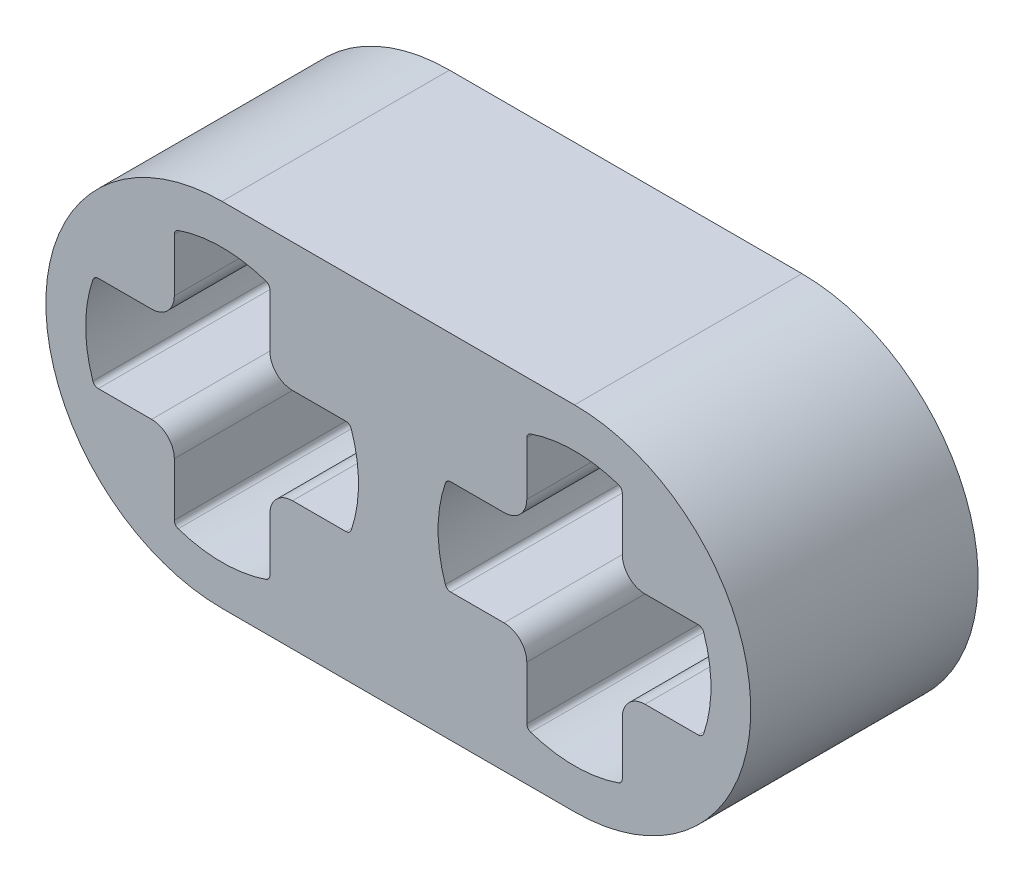
from build123d import *

# Parameters (mm, degrees)
BOSS_EXTRUDE1_DEPTH   = 4
CUT_EXTRUDE1_DEPTH    = 9.00312439
FILLET1_R             = 0.4
FILLET2_R             = 0.4
FILLET3_R             = 0.4
FILLET4_R             = 0.4
FILLET5_R             = 0.1
FILLET6_R             = 0.1
FILLET7_R             = 0.1
FILLET8_R             = 0.1
FILLET9_R             = 0.1
FILLET10_R            = 0.1
FILLET11_R            = 0.1
FILLET12_R            = 0.1
FILLET1_OF_MIRROR1_R  = 0.4
FILLET2_OF_MIRROR1_R  = 0.4
FILLET3_OF_MIRROR1_R  = 0.4
FILLET4_OF_MIRROR1_R  = 0.4
FILLET5_OF_MIRROR1_R  = 0.1
FILLET6_OF_MIRROR1_R  = 0.1
FILLET7_OF_MIRROR1_R  = 0.1
FILLET8_OF_MIRROR1_R  = 0.1
FILLET9_OF_MIRROR1_R  = 0.1
FILLET10_OF_MIRROR1_R = 0.1
FILLET11_OF_MIRROR1_R = 0.1
FILLET12_OF_MIRROR1_R = 0.1


with BuildPart() as part:
    # Sketch2 → Boss-Extrude1 (new body)
    with BuildSketch(Plane.XY):
        with BuildLine():
            Line((-3.1, 3.1), (3.1, 3.1))
            ThreePointArc((3.1, 3.1), (6.2, 0), (3.1, -3.1))
            Line((3.1, -3.1), (-3.1, -3.1))
            ThreePointArc((-3.1, -3.1), (-6.2, 0), (-3.1, 3.1))
        make_face()
    extrude(amount=-BOSS_EXTRUDE1_DEPTH)

    # Sketch4 → Cut-Extrude1 (cut, through all)
    with BuildSketch(Plane.XY):
        with BuildLine():
            Line((-3.94, -0.84), (-3.94, -2.248199279))
            ThreePointArc((-3.94, -2.248199279), (-3.1, -2.4), (-2.26, -2.248199279))
            Line((-2.26, -2.248199279), (-2.26, -0.84))
            Line((-2.26, -0.84), (-0.851800721, -0.84))
            ThreePointArc((-0.851800721, -0.84), (-0.7, 0), (-0.851800721, 0.84))
            Line((-0.851800721, 0.84), (-2.26, 0.84))
            Line((-2.26, 0.84), (-2.26, 2.248199279))
            ThreePointArc((-2.26, 2.248199279), (-3.1, 2.4), (-3.94, 2.248199279))
            Line((-3.94, 2.248199279), (-3.94, 0.84))
            Line((-3.94, 0.84), (-5.348199279, 0.84))
            ThreePointArc((-5.348199279, 0.84), (-5.5, 0), (-5.348199279, -0.84))
            Line((-5.348199279, -0.84), (-3.94, -0.84))
        make_face()
    cut_extrude1 = extrude(amount=-CUT_EXTRUDE1_DEPTH, mode=Mode.SUBTRACT)

    # Fillet1
    fillet1_edges = [part.edges().sort_by_distance(p)[0] for p in [
        (-3.94, -0.84, -2),
    ]]
    fillet(fillet1_edges, radius=FILLET1_R)

    # Fillet2
    fillet2_edges = [part.edges().sort_by_distance(p)[0] for p in [
        (-3.94, 0.84, -2),
    ]]
    fillet(fillet2_edges, radius=FILLET2_R)

    # Fillet3
    fillet3_edges = [part.edges().sort_by_distance(p)[0] for p in [
        (-2.26, 0.84, -2),
    ]]
    fillet(fillet3_edges, radius=FILLET3_R)

    # Fillet4
    fillet4_edges = [part.edges().sort_by_distance(p)[0] for p in [
        (-2.26, -0.84, -2),
    ]]
    fillet(fillet4_edges, radius=FILLET4_R)

    # Fillet5
    fillet5_edges = [part.edges().sort_by_distance(p)[0] for p in [
        (-3.94, -2.248199279, -2),
    ]]
    fillet(fillet5_edges, radius=FILLET5_R)

    # Fillet6
    fillet6_edges = [part.edges().sort_by_distance(p)[0] for p in [
        (-2.26, -2.248199279, -2),
    ]]
    fillet(fillet6_edges, radius=FILLET6_R)

    # Fillet7
    fillet7_edges = [part.edges().sort_by_distance(p)[0] for p in [
        (-0.851800721, 0.84, -2),
    ]]
    fillet(fillet7_edges, radius=FILLET7_R)

    # Fillet8
    fillet8_edges = [part.edges().sort_by_distance(p)[0] for p in [
        (-0.851800721, -0.84, -2),
    ]]
    fillet(fillet8_edges, radius=FILLET8_R)

    # Fillet9
    fillet9_edges = [part.edges().sort_by_distance(p)[0] for p in [
        (-2.26, 2.248199279, -2),
    ]]
    fillet(fillet9_edges, radius=FILLET9_R)

    # Fillet10
    fillet10_edges = [part.edges().sort_by_distance(p)[0] for p in [
        (-3.94, 2.248199279, -2),
    ]]
    fillet(fillet10_edges, radius=FILLET10_R)

    # Fillet11
    fillet11_edges = [part.edges().sort_by_distance(p)[0] for p in [
        (-5.348199279, 0.84, -2),
    ]]
    fillet(fillet11_edges, radius=FILLET11_R)

    # Fillet12
    fillet12_edges = [part.edges().sort_by_distance(p)[0] for p in [
        (-5.348199279, -0.84, -2),
    ]]
    fillet(fillet12_edges, radius=FILLET12_R)

    # Mirror1: Cut-Extrude1 across plane
    add(cut_extrude1.mirror(Plane(origin=(0, 0, 0), x_dir=(0, 0, 1), z_dir=(1, 0, 0))), mode=Mode.SUBTRACT)

    # Fillet1 of Mirror1
    fillet1_of_mirror1_edges = [part.edges().sort_by_distance(p)[0] for p in [
        (3.94, -0.84, -2),
    ]]
    fillet(fillet1_of_mirror1_edges, radius=FILLET1_OF_MIRROR1_R)

    # Fillet2 of Mirror1
    fillet2_of_mirror1_edges = [part.edges().sort_by_distance(p)[0] for p in [
        (3.94, 0.84, -2),
    ]]
    fillet(fillet2_of_mirror1_edges, radius=FILLET2_OF_MIRROR1_R)

    # Fillet3 of Mirror1
    fillet3_of_mirror1_edges = [part.edges().sort_by_distance(p)[0] for p in [
        (2.26, 0.84, -2),
    ]]
    fillet(fillet3_of_mirror1_edges, radius=FILLET3_OF_MIRROR1_R)

    # Fillet4 of Mirror1
    fillet4_of_mirror1_edges = [part.edges().sort_by_distance(p)[0] for p in [
        (2.26, -0.84, -2),
    ]]
    fillet(fillet4_of_mirror1_edges, radius=FILLET4_OF_MIRROR1_R)

    # Fillet5 of Mirror1
    fillet5_of_mirror1_edges = [part.edges().sort_by_distance(p)[0] for p in [
        (3.94, -2.248199279, -2),
    ]]
    fillet(fillet5_of_mirror1_edges, radius=FILLET5_OF_MIRROR1_R)

    # Fillet6 of Mirror1
    fillet6_of_mirror1_edges = [part.edges().sort_by_distance(p)[0] for p in [
        (2.26, -2.248199279, -2),
    ]]
    fillet(fillet6_of_mirror1_edges, radius=FILLET6_OF_MIRROR1_R)

    # Fillet7 of Mirror1
    fillet7_of_mirror1_edges = [part.edges().sort_by_distance(p)[0] for p in [
        (0.851800721, 0.84, -2),
    ]]
    fillet(fillet7_of_mirror1_edges, radius=FILLET7_OF_MIRROR1_R)

    # Fillet8 of Mirror1
    fillet8_of_mirror1_edges = [part.edges().sort_by_distance(p)[0] for p in [
        (0.851800721, -0.84, -2),
    ]]
    fillet(fillet8_of_mirror1_edges, radius=FILLET8_OF_MIRROR1_R)

    # Fillet9 of Mirror1
    fillet9_of_mirror1_edges = [part.edges().sort_by_distance(p)[0] for p in [
        (2.26, 2.248199279, -2),
    ]]
    fillet(fillet9_of_mirror1_edges, radius=FILLET9_OF_MIRROR1_R)

    # Fillet10 of Mirror1
    fillet10_of_mirror1_edges = [part.edges().sort_by_distance(p)[0] for p in [
        (3.94, 2.248199279, -2),
    ]]
    fillet(fillet10_of_mirror1_edges, radius=FILLET10_OF_MIRROR1_R)

    # Fillet11 of Mirror1
    fillet11_of_mirror1_edges = [part.edges().sort_by_distance(p)[0] for p in [
        (5.348199279, 0.84, -2),
    ]]
    fillet(fillet11_of_mirror1_edges, radius=FILLET11_OF_MIRROR1_R)

    # Fillet12 of Mirror1
    fillet12_of_mirror1_edges = [part.edges().sort_by_distance(p)[0] for p in [
        (5.348199279, -0.84, -2),
    ]]
    fillet(fillet12_of_mirror1_edges, radius=FILLET12_OF_MIRROR1_R)


solid = part.part
